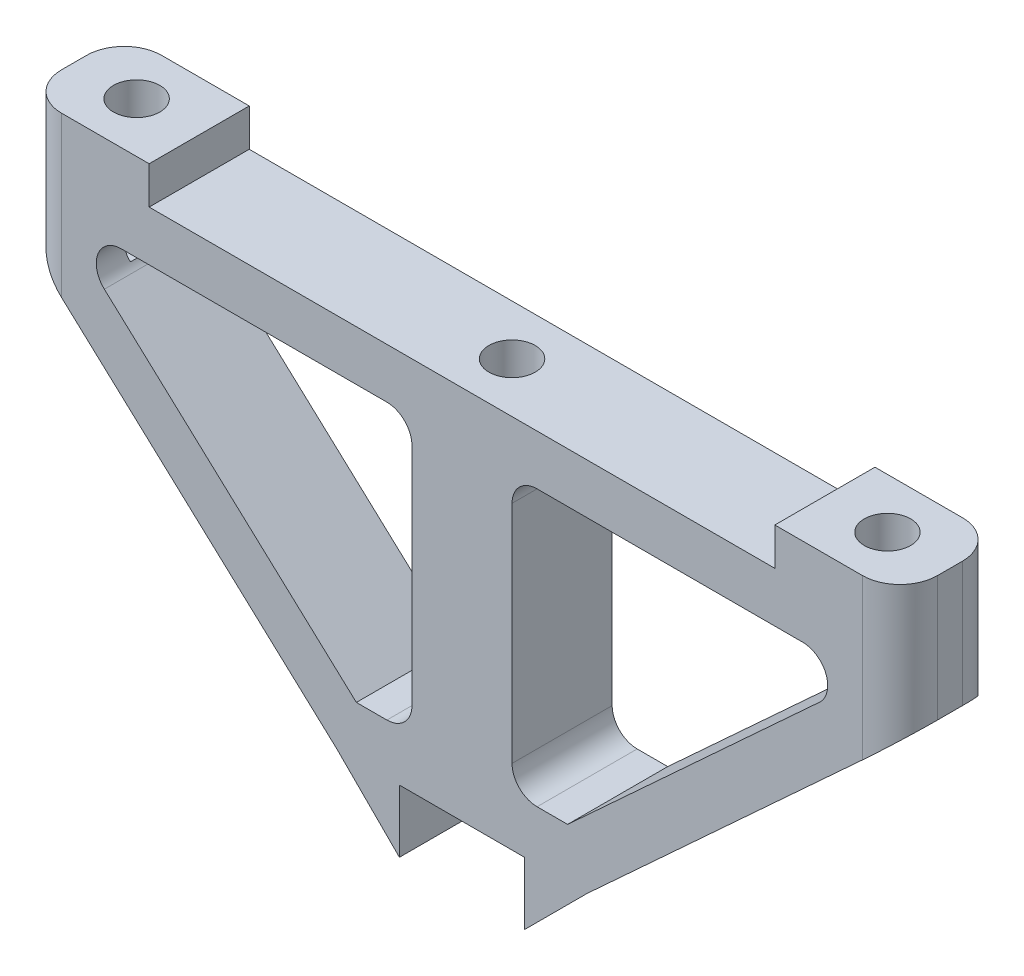
from build123d import *

# Parameters (mm, degrees)
EXTRUDE_1_DEPTH     = 8
FILLET_1_R          = 2
SKETCH_2_R          = 1.85
CUT_EXTRUDE_1_DEPTH = 7
CUT_EXTRUDE_START   = -8
SKETCH_3_R          = 1.85
CUT_EXTRUDE_2_DEPTH = 8
EXTRUDE_2_DEPTH     = 8
EXTRUDE_START       = 3
SKETCH_5_W          = 10
SKETCH_5_H          = 8
SKETCH_5_R          = 1.85
EXTRUDE_3_DEPTH     = 3
FILLET_2_R          = 3


with BuildPart() as part:
    # ｽｹｯﾁ1 → ﾎﾞｽ - 押し出し1 (new body)
    with BuildSketch(Plane.XY):
        Polygon((0, 0), (-10, 0), (-35, 23), (-35, 30), (0, 30), align=None)
        Polygon((-4, 26), (-4, 4), (-8.439899913, 4), (-32.352943391, 26), align=None, mode=Mode.SUBTRACT)
    extrude_1 = extrude(amount=EXTRUDE_1_DEPTH)

    # ﾐﾗｰ1: ﾎﾞｽ - 押し出し1 across plane
    add(extrude_1.mirror(Plane(origin=(0, 30, 8), x_dir=(0, 0, 1), z_dir=(-1, 0, 0))))

    # ﾌｨﾚｯﾄ1
    fillet_1_edges = [part.edges().sort_by_distance(p)[0] for p in [
        (-4, 26, 4),
        (-32.352943391, 26, 4),
        (-4, 4, 4),
        (4, 26, 4),
        (4, 4, 4),
        (32.352943391, 26, 4),
    ]]
    fillet(fillet_1_edges, radius=FILLET_1_R)

    # ｽｹｯﾁ2 → ｶｯﾄ - 押し出し1 (cut)
    with BuildSketch(Plane(origin=(0, 30, 0), x_dir=(1, 0, 0), z_dir=(0, 1, 0))):
        with Locations(Location((0, -4, 0), (0, 0, 270))):
            Circle(SKETCH_2_R)
        with Locations(Location((-30, -4, 0), (0, 0, 270))):
            Circle(SKETCH_2_R)
        with Locations(Location((30, -4, 0), (0, 0, 270))):
            Circle(SKETCH_2_R)
    extrude(amount=-CUT_EXTRUDE_1_DEPTH, mode=Mode.SUBTRACT)

    # ｽｹｯﾁ3 → ｶｯﾄ - 押し出し2 (cut)
    with BuildSketch(Plane(origin=(0, 0, 0), x_dir=(-1, 0, 0), z_dir=(0, -1, 0)).offset(CUT_EXTRUDE_START)):
        with Locations(Location((0, -4, 0), (0, 0, 270))):
            Circle(SKETCH_3_R)
    extrude(amount=CUT_EXTRUDE_2_DEPTH, mode=Mode.SUBTRACT)

    # ｽｹｯﾁ4 → ﾎﾞｽ - 押し出し2 (add)
    with BuildSketch(Plane(origin=(0, 0, 0), x_dir=(-1, 0, 0), z_dir=(0, 0, -1))):
        Polygon((5, 0), (5, -5), (10, 0), align=None)
        Polygon((-10, 0), (-5, 0), (-5, -5), align=None)
    extrude(amount=-EXTRUDE_2_DEPTH)

    # ｽｹｯﾁ5 → ﾎﾞｽ - 押し出し3 (add)
    # profile 1 of 2: a face of its own
    with BuildSketch(Plane(origin=(0, 30, 0), x_dir=(1, 0, 0), z_dir=(0, 1, 0)).offset(EXTRUDE_START)):
        with Locations((30, -4)):
            Rectangle(SKETCH_5_W, SKETCH_5_H)
        with Locations(Location((30, -4, 0), (0, 0, 270))):
            Circle(SKETCH_5_R, mode=Mode.SUBTRACT)
    # profile 2 of 2: a face of its own
    with BuildSketch(Plane(origin=(0, 30, 0), x_dir=(1, 0, 0), z_dir=(0, 1, 0)).offset(EXTRUDE_START)):
        with Locations((-30, -4)):
            Rectangle(SKETCH_5_W, SKETCH_5_H)
        with Locations(Location((-30, -4, 0), (0, 0, 270))):
            Circle(SKETCH_5_R, mode=Mode.SUBTRACT)
    extrude(amount=-EXTRUDE_3_DEPTH)

    # ﾌｨﾚｯﾄ2
    fillet_2_edges = [part.edges().sort_by_distance(p)[0] for p in [
        (-35, 28, 8),
        (35, 28, 8),
        (35, 28, 0),
        (-35, 28, 0),
    ]]
    fillet(fillet_2_edges, radius=FILLET_2_R)


solid = part.part
